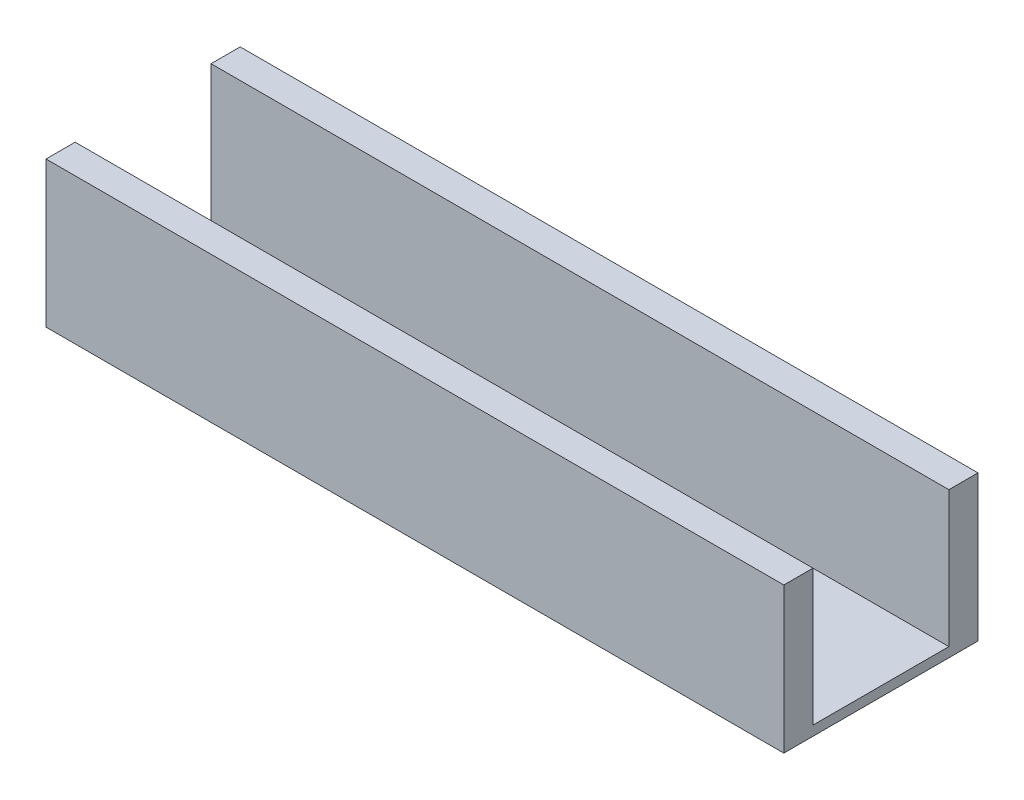
from build123d import *

# Parameters (mm, degrees)
ACRYLIC_SHEET_W     = 482.6
ACRYLIC_SHEET_H     = 127
BOSS_EXTRUDE1_DEPTH = 6.35
SKETCH2_W           = 482.6
SKETCH2_H           = 19.05
BOSS_EXTRUDE2_DEPTH = 88.9


with BuildPart() as part:
    # Acrylic Sheet → Boss-Extrude1 (new body)
    with BuildSketch(Plane(origin=(0, 0, 0), x_dir=(1, 0, 0), z_dir=(0, 1, 0))):
        with Locations((241.3, 63.5)):
            Rectangle(ACRYLIC_SHEET_W, ACRYLIC_SHEET_H)
    extrude(amount=BOSS_EXTRUDE1_DEPTH)

    # Sketch2 → Boss-Extrude2 (add)
    with BuildSketch(Plane(origin=(0, 6.35, 0), x_dir=(1, 0, 0), z_dir=(0, 1, 0))):
        with Locations((241.3, 9.525)):
            Rectangle(SKETCH2_W, SKETCH2_H)
        with Locations((241.3, 117.475)):
            Rectangle(SKETCH2_W, SKETCH2_H)
    extrude(amount=BOSS_EXTRUDE2_DEPTH)


solid = part.part
